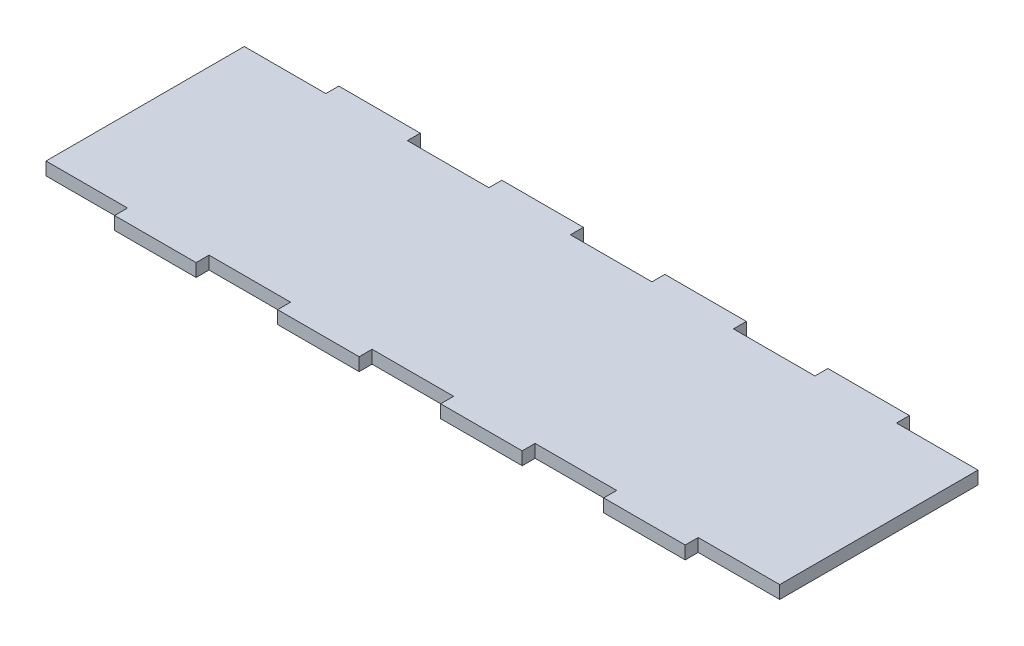
from build123d import *

# Parameters (mm, degrees)
BOSS_EXTRUDE1_DEPTH = 3.175


with BuildPart() as part:
    # Sketch1 → Boss-Extrude1 (new body)
    with BuildSketch(Plane(origin=(0, 0, 0), x_dir=(1, 0, 0), z_dir=(0, 1, 0))):
        Polygon((0, 0), (20, 0), (20, 3.175), (40, 3.175), (40, 0), (60, 0), (60, 3.175), (80, 3.175), (80, 0), (100, 0), (100, 3.175), (120, 3.175), (120, 0), (140, 0), (140, 3.175), (160, 3.175), (160, 0), (180, 0), (180, -48.65), (160, -48.65), (160, -51.825), (140, -51.825), (140, -48.65), (120, -48.65), (120, -51.825), (100, -51.825), (100, -48.65), (80, -48.65), (80, -51.825), (60, -51.825), (60, -48.65), (40, -48.65), (40, -51.825), (20, -51.825), (20, -48.65), (0, -48.65), align=None)
    extrude(amount=BOSS_EXTRUDE1_DEPTH)


solid = part.part
